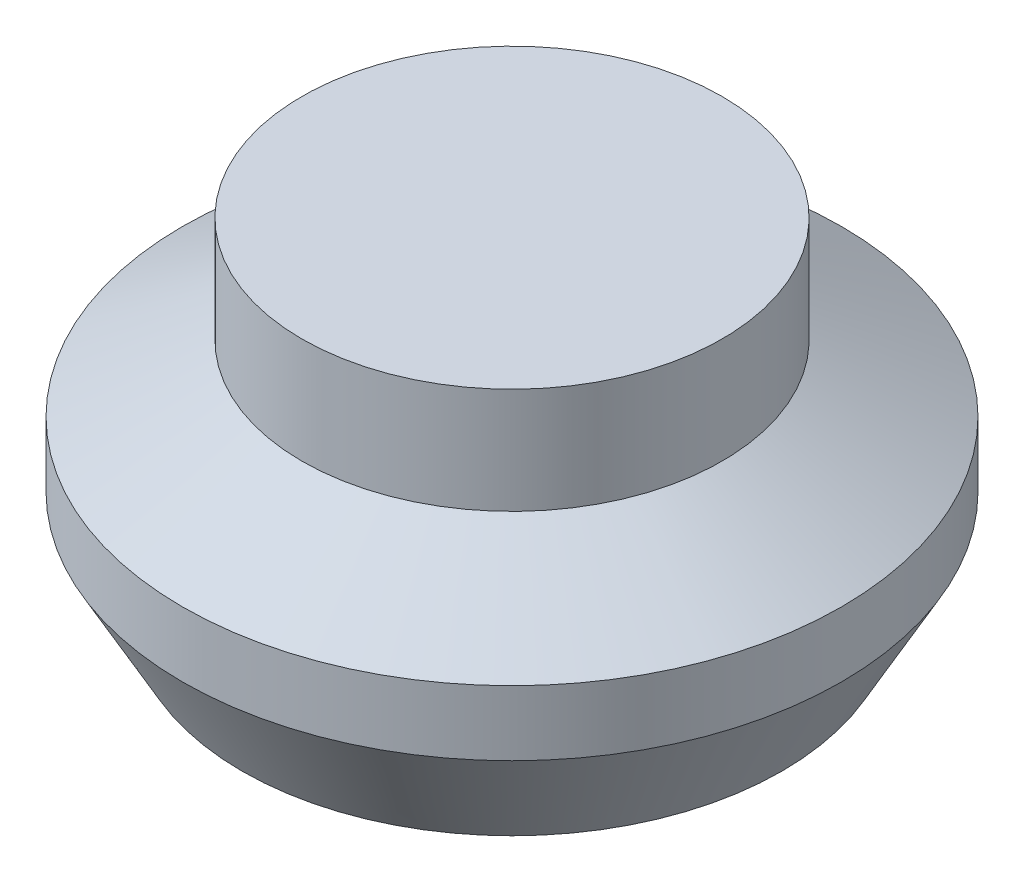
from build123d import *


with BuildPart() as part:
    # Sketch1 → Revolve1 (revolve)
    with BuildSketch(Plane.XY, mode=Mode.PRIVATE) as revolve1_sk:
        Polygon((0, 36.835054409), (22.40731975, 36.835054409), (22.40731975, 25.550792664), (35.142415147, 18.457828139), (35.142415147, 11.526067353), (28.774867449, 0.093424894), (14.024725311, 0.093424894), (0, -17.651809443), align=None)
    revolve(revolve1_sk.sketch.rotate(Axis((0, 0, 0), (0, 1, 0)), 90), axis=Axis((0, 0, 0), (0, 1, 0)))


solid = part.part
